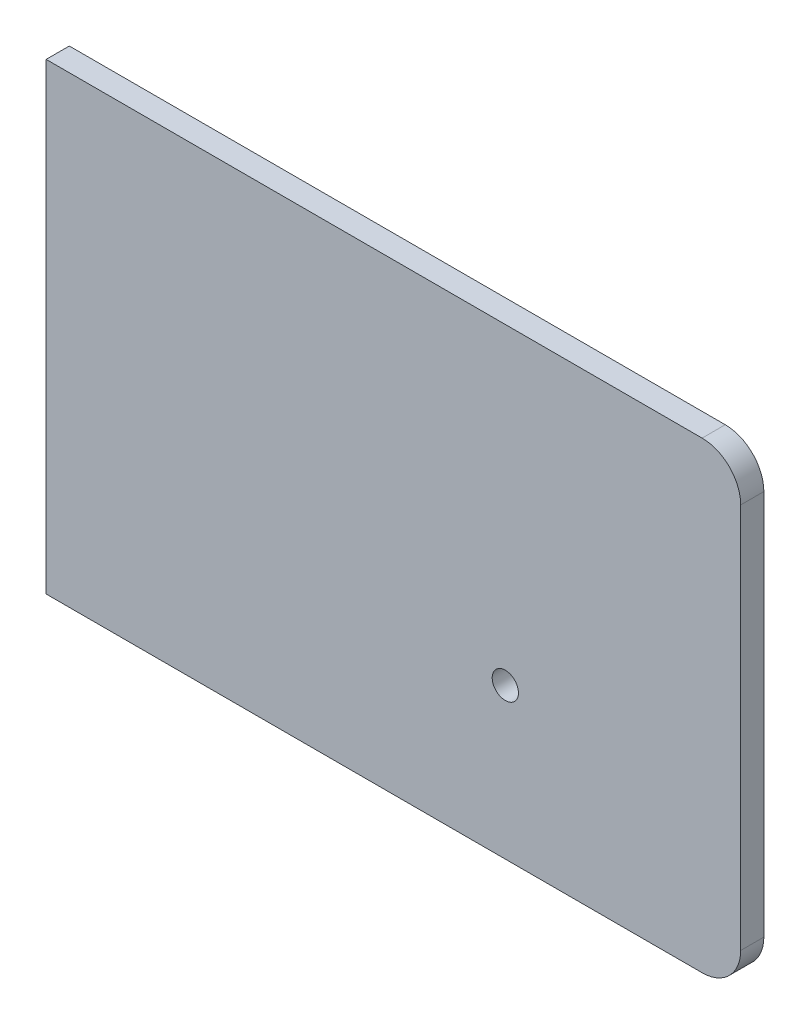
from build123d import *

# Parameters (mm, degrees)
SKETCH2_W           = 180
SKETCH2_H           = 120
SKETCH2_R           = 3.4
BOSS_EXTRUDE1_DEPTH = 6
FILLET1_R           = 10


with BuildPart() as part:
    # Sketch2 → Boss-Extrude1 (new body)
    with BuildSketch(Plane.XY):
        with Locations((112.677406729, 348.328575943)):
            Rectangle(SKETCH2_W, SKETCH2_H)
        with Locations((141.677406729, 327.328575943)):
            Circle(SKETCH2_R, mode=Mode.SUBTRACT)
    extrude(amount=BOSS_EXTRUDE1_DEPTH)

    # Fillet1
    fillet1_edges = [part.edges().sort_by_distance(p)[0] for p in [
        (202.677406729, 288.328575943, 3),
        (202.677406729, 408.328575943, 3),
    ]]
    fillet(fillet1_edges, radius=FILLET1_R)


solid = part.part
